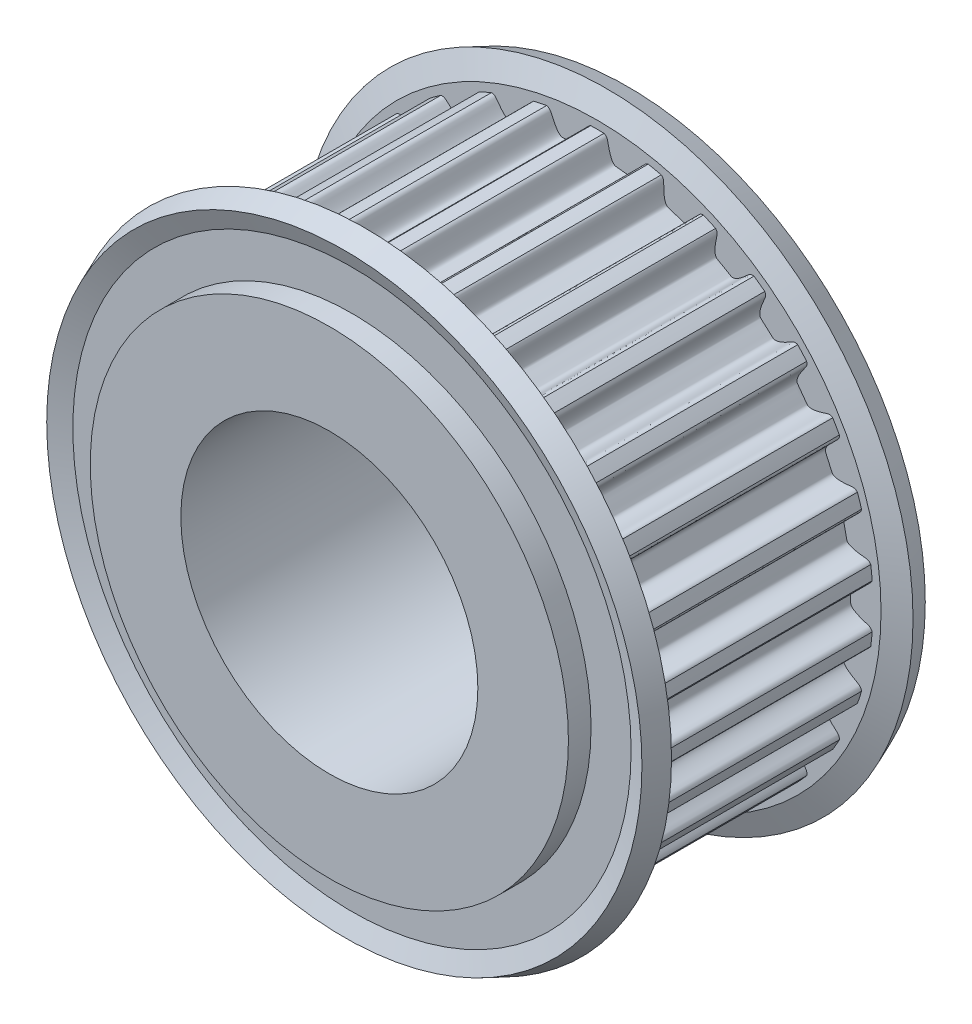
from build123d import *

# Parameters (mm, degrees)
TOOTHEXTRUDECUTGEARBELT01_DEPTH = 3.749999944
TOOTH_PATTERN_30_COUNT          = 30
BOREREVOLVESKETCH_W             = 10.547999842
BOREREVOLVESKETCH_H             = 5


with BuildPart() as part:
    # SketchRevolveGearBelt01 → Gates_PowerGrip_GT_2mm, 6mm Belt Width (revolve)
    with BuildSketch(Plane(origin=(0, 0, 0), x_dir=(0, 0, -1), z_dir=(1, 0, 0)), mode=Mode.PRIVATE) as gates_powergrip_gt_2mm_6mm_belt_width_sk:
        Polygon((5.273999921, 0), (5.273999921, 8.049296465), (4.511999932, 8.049296465), (4.511999932, 9.39772522), (4.769626867, 10.01969166), (4.065630673, 10.311296431), (3.749999944, 9.549296442), (3.749999944, 9.280480626), (-3.749999944, 9.280480626), (-3.749999944, 9.549296442), (-4.065630673, 10.311296431), (-4.769626867, 10.01969166), (-4.511999932, 9.39772522), (-4.511999932, 8.049296465), (-5.273999921, 8.049296465), (-5.273999921, 0), align=None)
    revolve(gates_powergrip_gt_2mm_6mm_belt_width_sk.sketch.rotate(Axis((0, 0, 0), (0, 0, -1)), 90), axis=Axis((0, 0, 0), (0, 0, -1)))

    # SketchToothGearBelt01 → ToothExtrudeCutGearBelt01 (cut, symmetric)
    with BuildSketch(Plane.XY):
        with BuildLine():
            ThreePointArc((9.259469869, 0.812097889), (9.295013999, 0), (9.259469869, -0.812097889))
            add(Edge.make_bspline(
                [(9.259469869, -0.812097889), (9.259882643, -0.798926426), (9.258535745, -0.779109129), (9.252881928, -0.753334284), (9.246755053, -0.734515852), (9.238801169, -0.716393821), (9.229098, -0.699145002), (9.217740163, -0.682937939), (9.204838756, -0.667930081), (9.190518793, -0.65427062), (9.174923394, -0.642082736), (9.158192233, -0.631523205), (9.140535394, -0.622553924), (9.096806178, -0.606636992), (9.040654354, -0.589254035), (8.974000339, -0.567478509), (8.923234955, -0.549822047), (8.875536871, -0.532182767), (8.830912224, -0.514541632), (8.789358436, -0.496903406), (8.750874778, -0.479266882), (8.715459684, -0.46163211), (8.68311132, -0.443998471), (8.653827322, -0.426364888), (8.627604868, -0.408729361), (8.604440496, -0.39108843), (8.584331378, -0.373436343), (8.567273563, -0.355764081), (8.553273739, -0.338058507), (8.542322401, -0.320303478), (8.534501566, -0.302483729), (8.529637264, -0.284599108), (8.527464323, -0.250294946), (8.531227193, -0.199977901), (8.531655597, -0.133284358), (8.532656984, -0.066646885), (8.532835685, 0), (8.532656984, 0.066646885), (8.531655597, 0.133284358), (8.531227193, 0.199977901), (8.527464323, 0.250294946), (8.529637264, 0.284599108), (8.534501566, 0.302483729), (8.542322401, 0.320303478), (8.553273739, 0.338058507), (8.567273563, 0.355764081), (8.584331378, 0.373436343), (8.604440496, 0.39108843), (8.627604868, 0.408729361), (8.653827322, 0.426364888), (8.68311132, 0.443998471), (8.715459684, 0.46163211), (8.750874778, 0.479266882), (8.789358436, 0.496903406), (8.830912224, 0.514541632), (8.875536871, 0.532182767), (8.923234955, 0.549822047), (8.974000339, 0.567478509), (9.040654354, 0.589254035), (9.096806178, 0.606636992), (9.140535394, 0.622553924), (9.158192233, 0.631523205), (9.174923394, 0.642082736), (9.190518793, 0.65427062), (9.204838756, 0.667930081), (9.217740163, 0.682937939), (9.229098, 0.699145002), (9.238801169, 0.716393821), (9.246755053, 0.734515852), (9.252881928, 0.753334284), (9.258535745, 0.779109129), (9.259882643, 0.798926426), (9.259469869, 0.812097889)],
                knots=[0, 0, 0, 0, 0.015923832, 0.023885748, 0.031847664, 0.039809581, 0.047771497, 0.055733413, 0.063695329, 0.071657245, 0.079619161, 0.087581077, 0.095542993, 0.10350491, 0.143783134, 0.166612007, 0.18826668, 0.208754844, 0.228085578, 0.246269698, 0.263320202, 0.279252862, 0.294087016, 0.307846634, 0.320561765, 0.332270503, 0.343021643, 0.352878214, 0.361921967, 0.370258601, 0.378022746, 0.385380527, 0.392526466, 0.419432991, 0.44628866, 0.47314433, 0.5, 0.52685567, 0.55371134, 0.580567009, 0.607473534, 0.614619473, 0.621977254, 0.629741399, 0.638078033, 0.647121786, 0.656978357, 0.667729497, 0.679438235, 0.692153366, 0.705912984, 0.720747138, 0.736679798, 0.753730302, 0.771914422, 0.791245156, 0.81173332, 0.833387993, 0.856216866, 0.89649509, 0.904457007, 0.912418923, 0.920380839, 0.928342755, 0.936304671, 0.944266587, 0.952228503, 0.960190419, 0.968152336, 0.976114252, 0.984076168, 1, 1, 1, 1], degree=3))
        make_face()
    toothextrudecutgearbelt01 = extrude(amount=TOOTHEXTRUDECUTGEARBELT01_DEPTH, both=True, mode=Mode.SUBTRACT)

    # Tooth Pattern, 30: ToothExtrudeCutGearBelt01 ×30 about axis
    tooth_pattern_30_axis = Axis((0, 0, 55), (0, 0, -1))
    for i in range(1, TOOTH_PATTERN_30_COUNT):
        add(toothextrudecutgearbelt01.rotate(tooth_pattern_30_axis, i * 360 / TOOTH_PATTERN_30_COUNT), mode=Mode.SUBTRACT)

    # BoreRevolveSketch → BoreRevolveCut (revolve, cut)
    with BuildSketch(Plane(origin=(0, 0, 0), x_dir=(0, 0, -1), z_dir=(1, 0, 0)), mode=Mode.PRIVATE) as borerevolvecut_sk:
        with Locations((0, 2.5)):
            Rectangle(BOREREVOLVESKETCH_W, BOREREVOLVESKETCH_H)
    revolve(borerevolvecut_sk.sketch.rotate(Axis((0, 0, 0), (0, 0, -1)), 90), axis=Axis((0, 0, 0), (0, 0, -1)), mode=Mode.SUBTRACT)


solid = part.part
